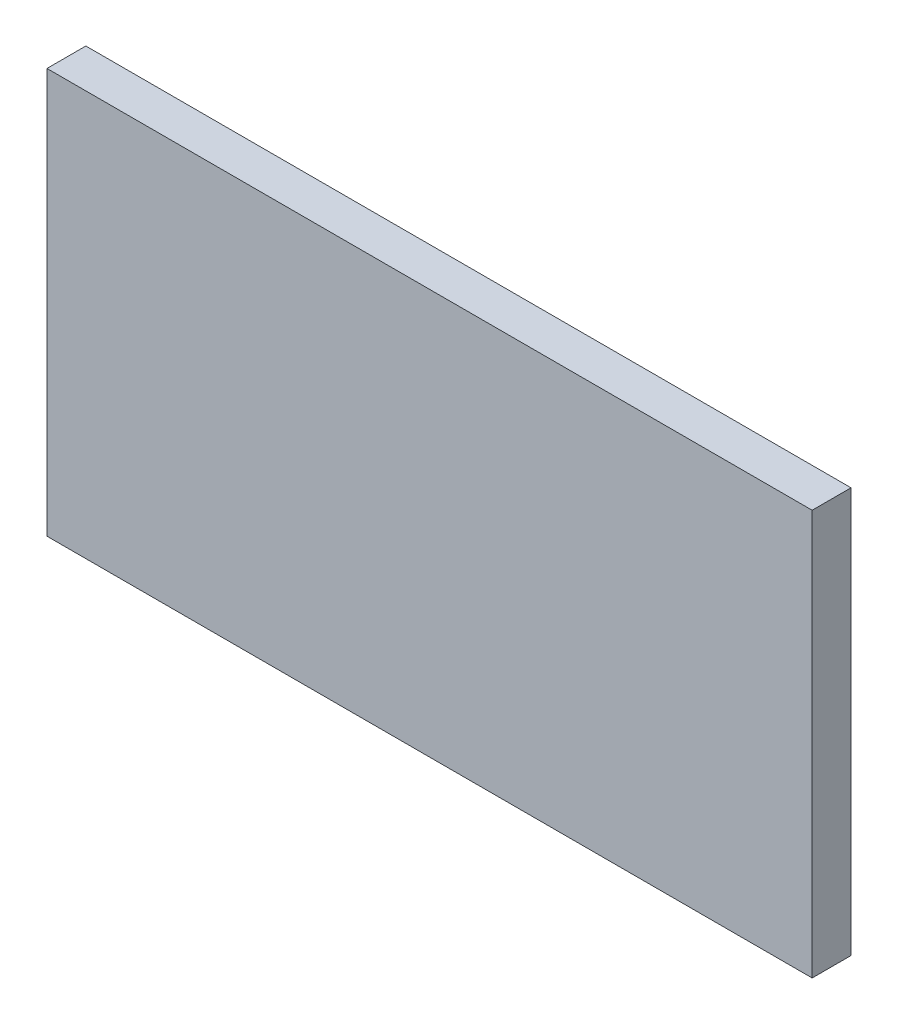
from build123d import *

# Parameters (mm, degrees)
ESQUISSE1_W        = 374
ESQUISSE1_H        = 198
BOSS_EXTRU_1_DEPTH = 19


with BuildPart() as part:
    # Esquisse1 → Boss.-Extru.1 (new body)
    with BuildSketch(Plane.XY):
        with Locations((187, 99)):
            Rectangle(ESQUISSE1_W, ESQUISSE1_H)
    extrude(amount=BOSS_EXTRU_1_DEPTH)


solid = part.part
